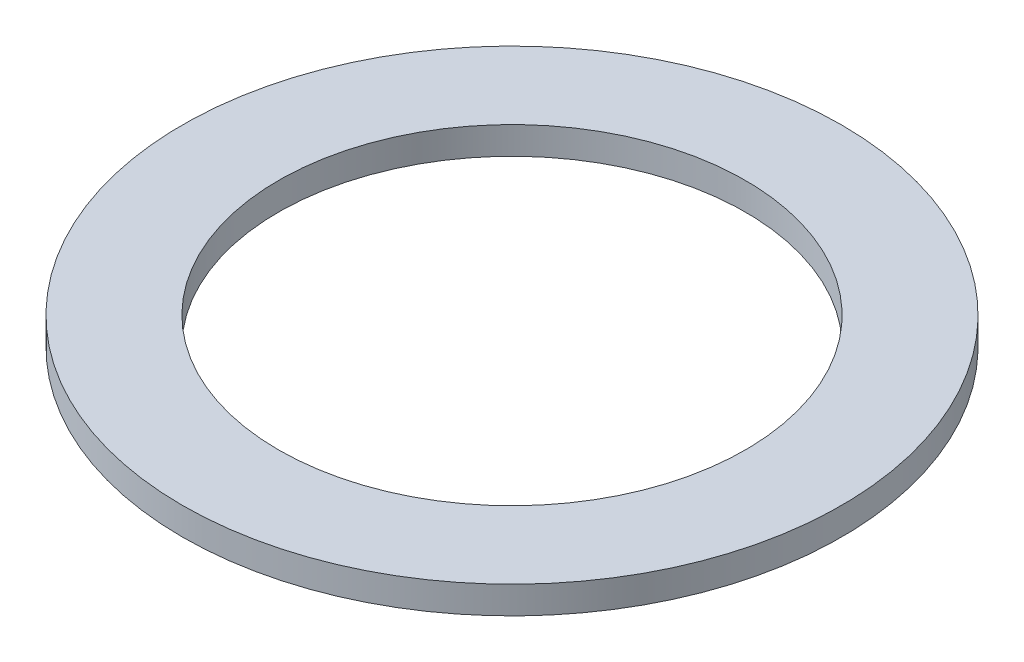
from build123d import *

# Parameters (mm, degrees)
SKETCH1_R           = 76.2
SKETCH1_R_2         = 53.975
BOSS_EXTRUDE1_DEPTH = 3.175


with BuildPart() as part:
    # Sketch1 → Boss-Extrude1 (new, symmetric)
    with BuildSketch(Plane(origin=(0, 0, 0), x_dir=(1, 0, 0), z_dir=(0, 1, 0))):
        with Locations(Location((0, 0, 0), (0, 0, 270))):
            Circle(SKETCH1_R)
        with Locations(Location((0, 0, 0), (0, 0, 270))):
            Circle(SKETCH1_R_2, mode=Mode.SUBTRACT)
    extrude(amount=BOSS_EXTRUDE1_DEPTH, both=True)


solid = part.part
